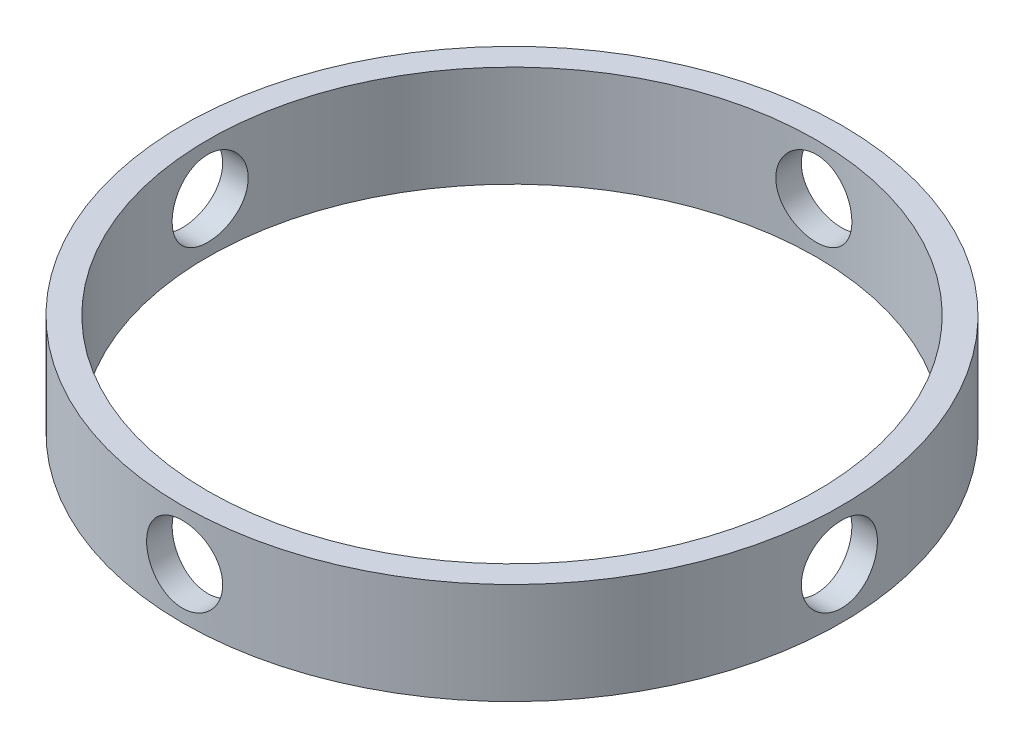
from build123d import *

# Parameters (mm, degrees)
SKETCH1_R               = 65
SKETCH1_R_2             = 60
BOSS_EXTRUDE1_DEPTH     = 20
CUT_EXTRUDE1_DEPTH      = 95.074438611
CUT_EXTRUDE1_DEPTH_BACK = 95.074438611
SKETCH2_R               = 7.5
CUT_EXTRUDE2_DEPTH      = 95.074438771
CUT_EXTRUDE2_DEPTH_BACK = 95.074438771
SKETCH3_R               = 7.5


with BuildPart() as part:
    # Sketch1 → Boss-Extrude1 (new body)
    with BuildSketch(Plane(origin=(0, 0, 0), x_dir=(1, 0, 0), z_dir=(0, 1, 0))):
        with Locations(Location((0, 0, 0), (0, 0, 270))):
            Circle(SKETCH1_R)
        with Locations(Location((0, 0, 0), (0, 0, 270))):
            Circle(SKETCH1_R_2, mode=Mode.SUBTRACT)
    extrude(amount=BOSS_EXTRUDE1_DEPTH)

    # Sketch2 → Cut-Extrude1 (cut, two sides: drawn at the far end of the back side and taken through both)
    with BuildSketch(Plane.XY.offset(-CUT_EXTRUDE1_DEPTH_BACK)):
        with Locations((0, 10)):
            Circle(SKETCH2_R)
    extrude(amount=CUT_EXTRUDE1_DEPTH + CUT_EXTRUDE1_DEPTH_BACK, mode=Mode.SUBTRACT)

    # Sketch3 → Cut-Extrude2 (cut, two sides: drawn at the far end of the back side and taken through both)
    with BuildSketch(Plane(origin=(0, 0, 0), x_dir=(0, 0, -1), z_dir=(1, 0, 0)).offset(-CUT_EXTRUDE2_DEPTH_BACK)):
        with Locations((0, 10)):
            Circle(SKETCH3_R)
    extrude(amount=CUT_EXTRUDE2_DEPTH + CUT_EXTRUDE2_DEPTH_BACK, mode=Mode.SUBTRACT)


solid = part.part
